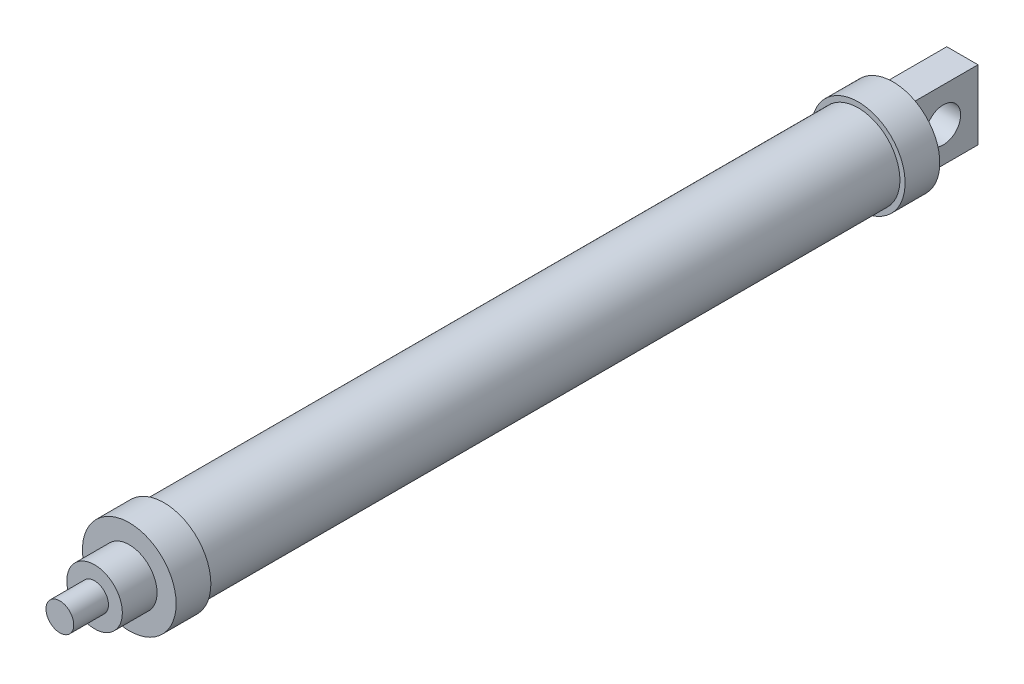
from build123d import *

# Parameters (mm, degrees)
SKETCH1_R           = 13.5
BOSS_EXTRUDE1_DEPTH = 10
SKETCH2_R           = 8
BOSS_EXTRUDE2_DEPTH = 10
SKETCH3_R           = 12
BOSS_EXTRUDE3_DEPTH = 200
BOSS_EXTRUDE4_START = 10
SKETCH4_R           = 13.5
BOSS_EXTRUDE4_DEPTH = 10
SKETCH5_W           = 9
SKETCH5_H           = 20
BOSS_EXTRUDE5_DEPTH = 20
SKETCH6_R           = 5
CUT_EXTRUDE1_DEPTH  = 20
SKETCH8_R           = 4
BOSS_EXTRUDE6_DEPTH = 10


with BuildPart() as part:
    # Sketch1 → Boss-Extrude1 (new body)
    with BuildSketch(Plane.XY):
        Circle(SKETCH1_R)
    extrude(amount=BOSS_EXTRUDE1_DEPTH)

    # Sketch2 → Boss-Extrude2 (add)
    with BuildSketch(Plane.XY.offset(10)):
        Circle(SKETCH2_R)
    extrude(amount=BOSS_EXTRUDE2_DEPTH)

    # Sketch3 → Boss-Extrude3 (add)
    with BuildSketch(Plane(origin=(0, 0, 0), x_dir=(-1, 0, 0), z_dir=(0, 0, -1))):
        Circle(SKETCH3_R)
    extrude(amount=BOSS_EXTRUDE3_DEPTH)

    # Sketch4 → Boss-Extrude4 (add)
    with BuildSketch(Plane(origin=(0, 0, -200), x_dir=(-1, 0, 0), z_dir=(0, 0, -1)).offset(BOSS_EXTRUDE4_START)):
        with Locations(Location((0, 0, 0), (0, 0, 180))):
            Circle(SKETCH4_R)
    extrude(amount=-BOSS_EXTRUDE4_DEPTH)

    # Sketch5 → Boss-Extrude5 (add)
    with BuildSketch(Plane(origin=(0, 0, -210), x_dir=(-1, 0, 0), z_dir=(0, 0, -1))):
        Rectangle(SKETCH5_W, SKETCH5_H)
    extrude(amount=BOSS_EXTRUDE5_DEPTH)

    # Sketch6 → Cut-Extrude1 (cut)
    with BuildSketch(Plane(origin=(4.5, 0, 0), x_dir=(0, 0, -1), z_dir=(1, 0, 0))):
        with Locations(Location((220, 0, 0), (0, 0, 90))):
            Circle(SKETCH6_R)
    extrude(amount=-CUT_EXTRUDE1_DEPTH, mode=Mode.SUBTRACT)

    # Sketch8 → Boss-Extrude6 (add)
    with BuildSketch(Plane.XY.offset(20)):
        Circle(SKETCH8_R)
    extrude(amount=BOSS_EXTRUDE6_DEPTH)


solid = part.part
